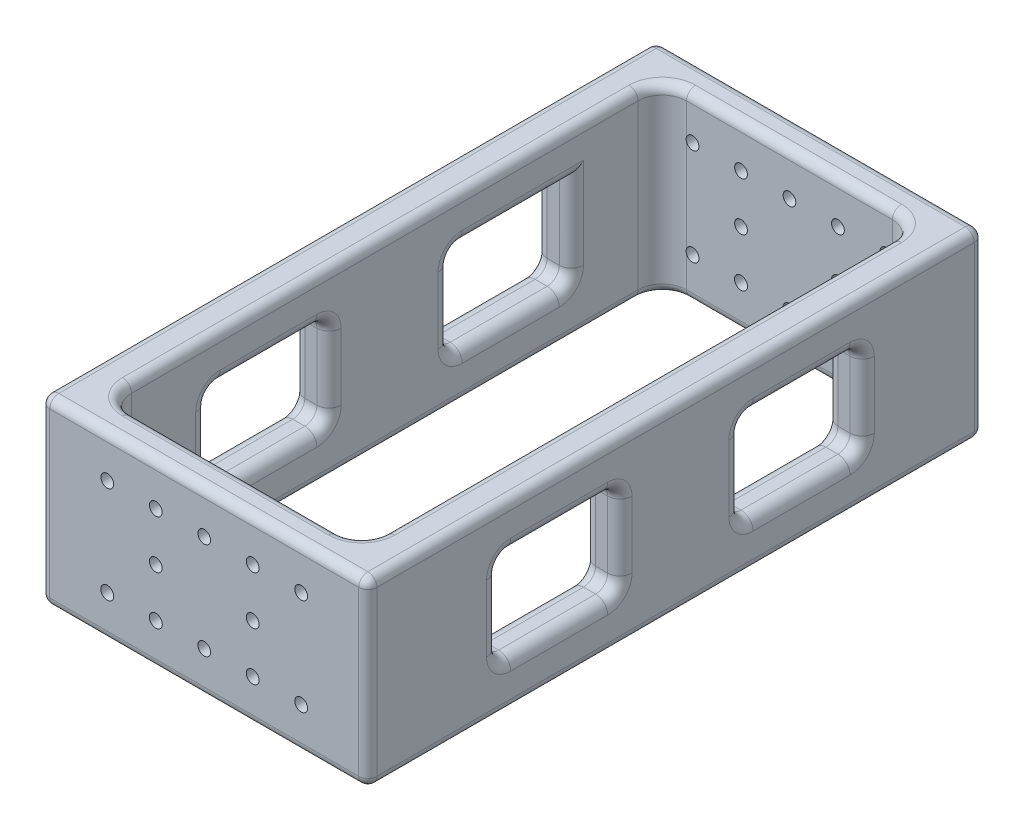
from build123d import *

# Parameters (mm, degrees)
SKETCH1_W           = 54
SKETCH1_H           = 101.6
BOSS_EXTRUDE1_DEPTH = 49
SKETCH2_W           = 42
SKETCH2_H           = 91.6
CUT_EXTRUDE1_DEPTH  = 126.058226439
SKETCH4_W           = 54
SKETCH4_H           = 101.6
CUT_EXTRUDE3_DEPTH  = 19
SKETCH6_W           = 20
SKETCH6_H           = 15
CUT_EXTRUDE5_DEPTH  = 119.905676904
FILLET1_R           = 2
FILLET3_R           = 4
FILLET4_R           = 4
SKETCH8_R           = 1.05
SKETCH8_R_2         = 1.072716653
SKETCH8_R_3         = 1.065381801
CUT_EXTRUDE7_DEPTH  = 10
SKETCH9_R           = 1.05
SKETCH9_R_2         = 1.065381801
SKETCH9_R_3         = 1.072716653
CUT_EXTRUDE8_DEPTH  = 10
FILLET5_R           = 1.5


with BuildPart() as part:
    # Sketch1 → Boss-Extrude1 (new body)
    with BuildSketch(Plane(origin=(0, 0, 0), x_dir=(1, 0, 0), z_dir=(0, 1, 0))):
        with Locations((27, 50.8)):
            Rectangle(SKETCH1_W, SKETCH1_H)
    extrude(amount=BOSS_EXTRUDE1_DEPTH)

    # Sketch2 → Cut-Extrude1 (cut, through all)
    with BuildSketch(Plane(origin=(0, 49, 0), x_dir=(1, 0, 0), z_dir=(0, 1, 0))):
        with Locations((27, 50.8)):
            Rectangle(SKETCH2_W, SKETCH2_H)
    extrude(amount=-CUT_EXTRUDE1_DEPTH, mode=Mode.SUBTRACT)

    # Sketch4 → Cut-Extrude3 (cut)
    with BuildSketch(Plane(origin=(0, 49, 0), x_dir=(1, 0, 0), z_dir=(0, 1, 0))):
        with Locations((27, 50.8)):
            Rectangle(SKETCH4_W, SKETCH4_H)
    extrude(amount=-CUT_EXTRUDE3_DEPTH, mode=Mode.SUBTRACT)

    # Sketch6 → Cut-Extrude5 (cut, through all)
    with BuildSketch(Plane.ZY):
        with Locations((-71.6, 15)):
            Rectangle(SKETCH6_W, SKETCH6_H)
        with Locations((-31.6, 15)):
            Rectangle(SKETCH6_W, SKETCH6_H)
    extrude(amount=-CUT_EXTRUDE5_DEPTH, mode=Mode.SUBTRACT)

    # Fillet1
    fillet1_edges = [part.edges().sort_by_distance(p)[0] for p in [
        (48, 15, -61.6),
        (48, 15, -81.6),
        (54, 15, -81.6),
        (54, 15, -61.6),
        (48, 15, -21.6),
        (48, 15, -41.6),
        (54, 15, -41.6),
        (54, 15, -21.6),
        (6, 15, -41.6),
        (6, 15, -21.6),
        (0, 15, -21.6),
        (0, 15, -41.6),
        (6, 22.5, -71.6),
        (0, 22.5, -71.6),
        (6, 15, -81.6),
        (0, 15, -81.6),
        (48, 22.5, -71.6),
        (51, 22.5, -61.6),
        (54, 22.5, -71.6),
        (51, 22.5, -81.6),
        (48, 22.5, -31.6),
        (51, 22.5, -21.6),
        (54, 22.5, -31.6),
        (51, 22.5, -41.6),
        (6, 22.5, -31.6),
        (3, 22.5, -41.6),
        (0, 22.5, -31.6),
        (3, 22.5, -21.6),
        (48, 7.5, -71.6),
        (51, 7.5, -81.6),
        (54, 7.5, -71.6),
        (51, 7.5, -61.6),
        (48, 7.5, -31.6),
        (51, 7.5, -41.6),
        (54, 7.5, -31.6),
        (51, 7.5, -21.6),
        (6, 7.5, -31.6),
        (3, 7.5, -21.6),
        (0, 7.5, -31.6),
        (3, 7.5, -41.6),
        (6, 15, -61.6),
        (3, 22.5, -61.6),
        (0, 15, -61.6),
        (6, 7.5, -71.6),
        (3, 7.5, -61.6),
        (0, 7.5, -71.6),
        (3, 7.5, -81.6),
    ]]
    fillet(fillet1_edges, radius=FILLET1_R)

    # Fillet3
    fillet3_edges = [part.edges().sort_by_distance(p)[0] for p in [
        (6, 15, -5),
        (48, 15, -5),
    ]]
    fillet(fillet3_edges, radius=FILLET3_R)

    # Fillet4
    fillet4_edges = [part.edges().sort_by_distance(p)[0] for p in [
        (6, 15, -96.6),
        (48, 15, -96.6),
    ]]
    fillet(fillet4_edges, radius=FILLET4_R)

    # Sketch8 → Cut-Extrude7 (cut)
    with BuildSketch(Plane(origin=(0, 0, -101.6), x_dir=(-1, 0, 0), z_dir=(0, 0, -1))):
        with Locations((-43, 23)):
            Circle(SKETCH8_R)
        with Locations((-35, 23)):
            Circle(SKETCH8_R)
        with Locations((-27, 23)):
            Circle(SKETCH8_R)
        with Locations((-19, 23)):
            Circle(SKETCH8_R)
        with Locations((-11, 23)):
            Circle(SKETCH8_R)
        with Locations((-35, 15)):
            Circle(SKETCH8_R)
        with Locations((-19, 15)):
            Circle(SKETCH8_R)
        with Locations((-43, 7)):
            Circle(SKETCH8_R)
        with Locations((-35, 7)):
            Circle(SKETCH8_R)
        with Locations((-27, 7)):
            Circle(SKETCH8_R)
        with Locations((-19, 7)):
            Circle(SKETCH8_R_2)
        with Locations((-11, 7)):
            Circle(SKETCH8_R_3)
    extrude(amount=-CUT_EXTRUDE7_DEPTH, mode=Mode.SUBTRACT)

    # Sketch9 → Cut-Extrude8 (cut)
    with BuildSketch(Plane(origin=(0, 0, -5), x_dir=(-1, 0, 0), z_dir=(0, 0, -1))):
        with Locations((-43, 23)):
            Circle(SKETCH9_R)
        with Locations((-35, 23)):
            Circle(SKETCH9_R)
        with Locations((-27, 23)):
            Circle(SKETCH9_R)
        with Locations((-19, 23)):
            Circle(SKETCH9_R)
        with Locations((-11, 23)):
            Circle(SKETCH9_R)
        with Locations((-19, 15)):
            Circle(SKETCH9_R)
        with Locations((-27, 7)):
            Circle(SKETCH9_R)
        with Locations((-35, 15)):
            Circle(SKETCH9_R)
        with Locations((-35, 7)):
            Circle(SKETCH9_R)
        with Locations((-43, 7)):
            Circle(SKETCH9_R)
        with Locations((-11, 7)):
            Circle(SKETCH9_R_2)
        with Locations((-19, 7)):
            Circle(SKETCH9_R_3)
    extrude(amount=-CUT_EXTRUDE8_DEPTH, mode=Mode.SUBTRACT)

    # Fillet5
    fillet5_edges = [part.edges().sort_by_distance(p)[0] for p in [
        (27, 30, -5),
        (27, 0, -5),
        (6, 30, -50.8),
        (48, 0, -50.8),
        (7.171572875, 30, -6.171572875),
        (7.171572875, 0, -6.171572875),
        (46.828427125, 30, -6.171572875),
        (46.828427125, 0, -6.171572875),
        (27, 30, -96.6),
        (27, 0, -96.6),
        (48, 30, -50.8),
        (6, 0, -50.8),
        (46.828427125, 30, -95.428427125),
        (46.828427125, 0, -95.428427125),
        (7.171572875, 30, -95.428427125),
        (7.171572875, 0, -95.428427125),
        (0, 15, -101.6),
        (54, 15, -101.6),
        (54, 15, 0),
        (0, 15, 0),
        (0, 30, -50.8),
        (27, 30, -101.6),
        (54, 30, -50.8),
        (27, 30, 0),
        (27, 0, -101.6),
        (54, 0, -50.8),
        (27, 0, 0),
        (0, 0, -50.8),
    ]]
    fillet(fillet5_edges, radius=FILLET5_R)


solid = part.part
